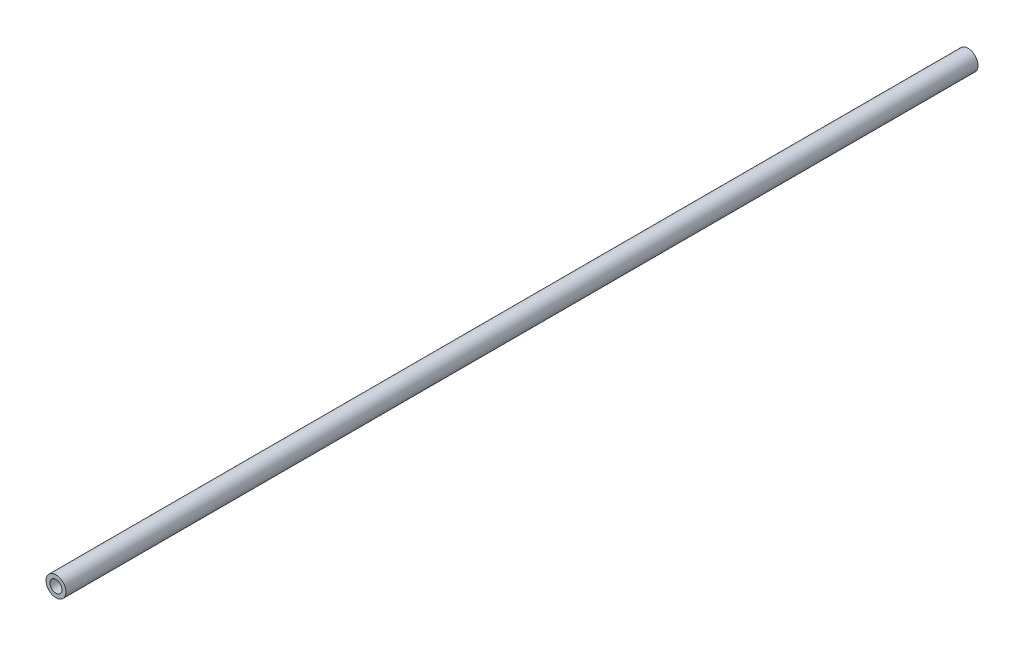
from build123d import *

# Parameters (mm, degrees)
SKETCH_1_R      = 5
SKETCH_1_R_2    = 3
EXTRUDE_1_DEPTH = 457.5


with BuildPart() as part:
    # 草图1 → 凸台-拉伸1 (new body)
    with BuildSketch(Plane.XY):
        with Locations(Location((0, 0, 0), (0, 0, 180))):
            Circle(SKETCH_1_R)
        with Locations(Location((0, 0, 0), (0, 0, 180))):
            Circle(SKETCH_1_R_2, mode=Mode.SUBTRACT)
    extrude(amount=EXTRUDE_1_DEPTH)


solid = part.part
